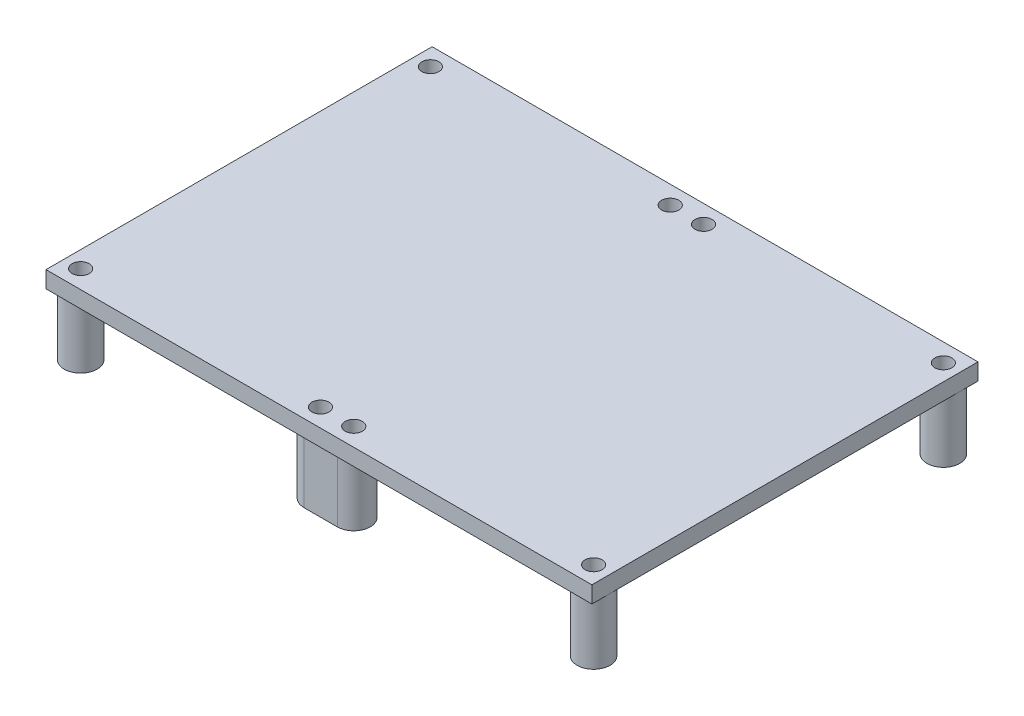
from build123d import *

# Parameters (mm, degrees)
BOSS_EXTRUDE1_DEPTH       = 3.175
SKETCH2_R                 = 3.14
BOSS_EXTRUDE2_DEPTH       = 15.04125
F_4_CLEARANCE_HOLE1_D     = 3.2639
F_4_CLEARANCE_HOLE1_DEPTH = 25.4
F_4_CLEARANCE_HOLE1_TIP   = 0.980574487


with BuildPart() as part:
    # Sketch1 → Boss-Extrude1 (new body)
    with BuildSketch(Plane(origin=(0, 0, 0), x_dir=(1, 0, 0), z_dir=(0, 1, 0))):
        Polygon((0, 36.805), (-0.035, 36.805), (-52.035, 36.805), (-52.035, -36.805), (-0.035, -36.805), (0, -36.805), align=None)
    extrude(amount=-BOSS_EXTRUDE1_DEPTH)

    # Sketch2 → Boss-Extrude2 (add)
    with BuildSketch(Plane(origin=(0, 0, 0), x_dir=(1, 0, 0), z_dir=(0, 1, 0))):
        with BuildLine():
            Line((-3.175, 30.2), (0, 30.2))
            Line((0, 30.2), (0, 36.48))
            Line((0, 36.48), (-3.175, 36.48))
            ThreePointArc((-3.175, 36.48), (-6.315, 33.34), (-3.175, 30.2))
        make_face()
        with BuildLine():
            Line((-3.175, -36.48), (0, -36.48))
            Line((0, -36.48), (0, -30.2))
            Line((0, -30.2), (-3.175, -30.2))
            ThreePointArc((-3.175, -30.2), (-6.315, -33.34), (-3.175, -36.48))
        make_face()
        with Locations(Location((-48.895, 33.34, 0), (0, 0, 270))):
            Circle(SKETCH2_R)
        with Locations(Location((-48.895, -33.34, 0), (0, 0, 270))):
            Circle(SKETCH2_R)
    extrude(amount=-BOSS_EXTRUDE2_DEPTH)

    # #4 Clearance Hole1
    with Locations(Plane(origin=(0, -15.04125, 0), x_dir=(-1, 0, 0), z_dir=(0, -1, 0))):
        with Locations((48.895, 33.34), (3.175, 33.34), (3.175, -33.34), (48.895, -33.34)):
            Hole(F_4_CLEARANCE_HOLE1_D / 2, depth=F_4_CLEARANCE_HOLE1_DEPTH)
            with Locations((0, 0, -(F_4_CLEARANCE_HOLE1_DEPTH + F_4_CLEARANCE_HOLE1_TIP / 2))):  # 118° drill point
                Cone(0, F_4_CLEARANCE_HOLE1_D / 2, F_4_CLEARANCE_HOLE1_TIP, mode=Mode.SUBTRACT)

    # Mirror1: part across plane


with BuildPart() as part_1:
    add(part.part)
    add(part.part.mirror(Plane(origin=(0, -3.175, 0), x_dir=(0, 0, 1), z_dir=(-1, 0, 0))))


solid = part_1.part
